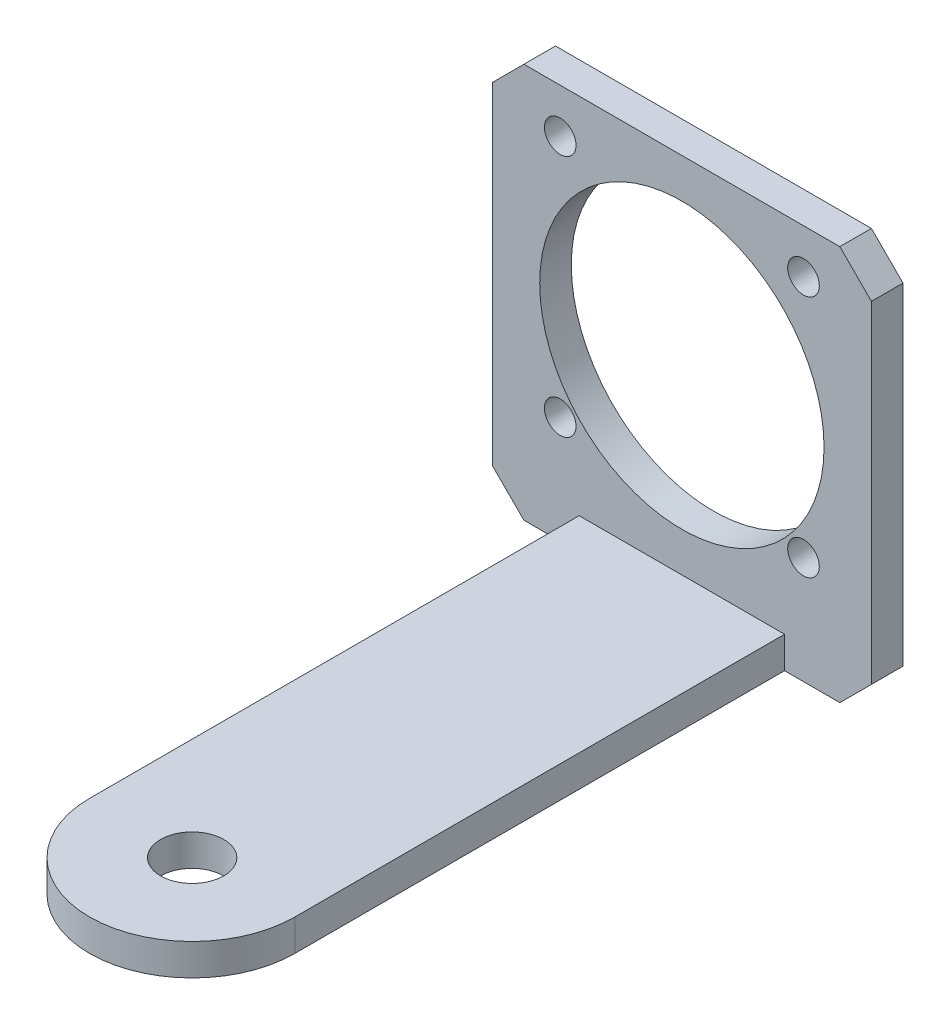
from build123d import *

# Parameters (mm, degrees)
SKETCH_2_R          = 6.5
EXTRUDE_1_DEPTH     = 2
SKETCH_3_R          = 2
CUT_EXTRUDE_2_DEPTH = 10.407443861
EXTRUDE_START       = -2
EXTRUDE_2_DEPTH     = 2
EXTRUDE_3_DEPTH     = 2
SKETCH_22_R         = 9
SKETCH_22_R_2       = 1
CUT_EXTRUDE_4_DEPTH = 2
CHAMFER_1_SIZE      = 2


with BuildPart() as part:
    # 草图2 → 凸台-拉伸1 (new body)
    with BuildSketch(Plane(origin=(0, 0, 0), x_dir=(1, 0, 0), z_dir=(0, 1, 0))):
        with Locations(Location((0, 0, 0), (0, 0, 270))):
            Circle(SKETCH_2_R)
    extrude(amount=EXTRUDE_1_DEPTH)

    # 草图3 → 切除-拉伸2 (cut, through all)
    with BuildSketch(Plane(origin=(0, 2, 0), x_dir=(1, 0, 0), z_dir=(0, 1, 0))):
        with Locations(Location((0, 0, 0), (0, 0, 270))):
            Circle(SKETCH_3_R)
    extrude(amount=-CUT_EXTRUDE_2_DEPTH, mode=Mode.SUBTRACT)

    # 草图4 → 凸台-拉伸2 (add)
    with BuildSketch(Plane(origin=(0, 2, 0), x_dir=(1, 0, 0), z_dir=(0, 1, 0)).offset(EXTRUDE_START)):
        with BuildLine():
            Line((6.5, 0), (6.5, 31))
            Line((6.5, 31), (3.899148682, 31))
            Line((3.899148682, 31), (-4.100851318, 31))
            Line((-4.100851318, 31), (-6.5, 31))
            Line((-6.5, 31), (-6.5, 0))
            ThreePointArc((-6.5, 0), (0, 6.5), (6.5, 0))
        make_face()
    extrude(amount=EXTRUDE_2_DEPTH)

    # 草图21 → 凸台-拉伸3 (add)
    with BuildSketch(Plane(origin=(0, 0, -31), x_dir=(-1, 0, 0), z_dir=(0, 0, -1))):
        Polygon((0, 0), (12, 0), (12, 25), (-12, 25), (-12, 0), align=None)
    extrude(amount=EXTRUDE_3_DEPTH)

    # 草图22 → 切除-拉伸4 (cut)
    with BuildSketch(Plane.XY.offset(-31)):
        with Locations((0, 13.5)):
            Circle(SKETCH_22_R)
        with Locations((7.7, 22.2)):
            Circle(SKETCH_22_R_2)
        with Locations((-7.7, 22.2)):
            Circle(SKETCH_22_R_2)
        with Locations((-7.7, 6.8)):
            Circle(SKETCH_22_R_2)
        with Locations((7.7, 6.8)):
            Circle(SKETCH_22_R_2)
    extrude(amount=-CUT_EXTRUDE_4_DEPTH, mode=Mode.SUBTRACT)

    # 倒角1
    chamfer_1_edges = [part.edges().sort_by_distance(p)[0] for p in [
        (12, 0, -32),
        (-12, 0, -32),
        (-12, 25, -32),
        (12, 25, -32),
    ]]
    chamfer(chamfer_1_edges, length=CHAMFER_1_SIZE)


solid = part.part
